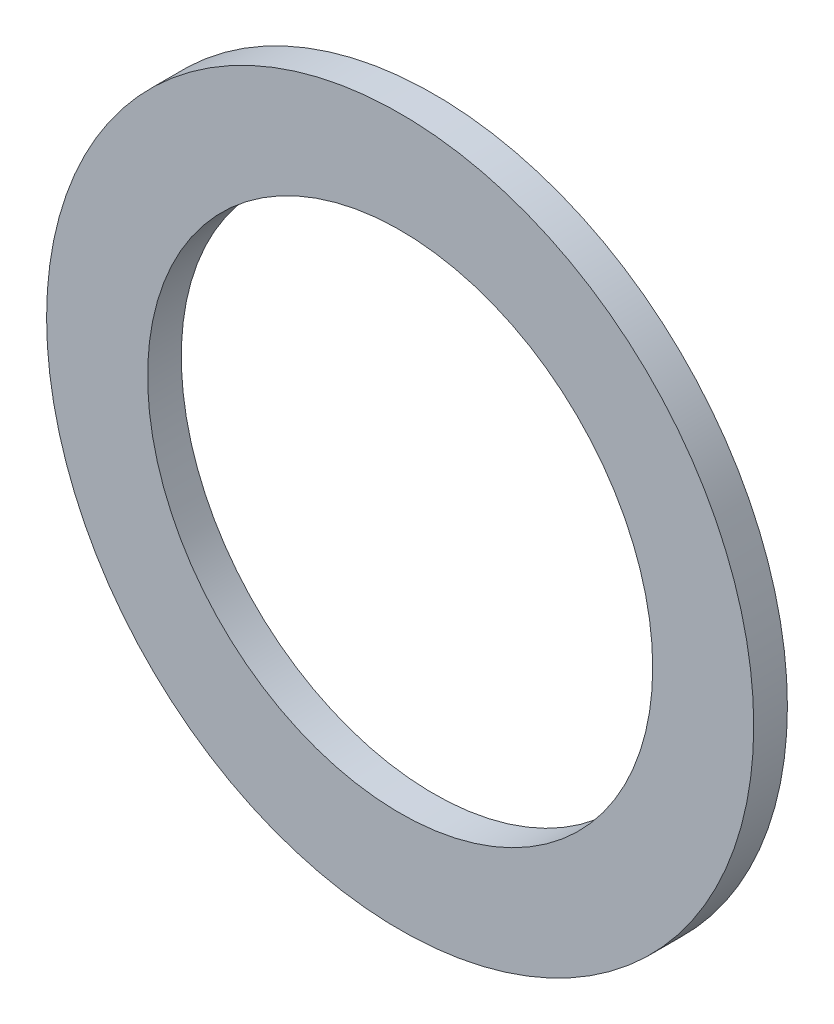
from build123d import *

# Parameters (mm, degrees)
SKETCH_1_R      = 10.5
SKETCH_1_R_2    = 7.5
EXTRUDE_1_DEPTH = 1


with BuildPart() as part:
    # 草图1 → 凸台-拉伸1 (new body)
    with BuildSketch(Plane.XY):
        Circle(SKETCH_1_R)
        Circle(SKETCH_1_R_2, mode=Mode.SUBTRACT)
    extrude(amount=EXTRUDE_1_DEPTH)


solid = part.part
